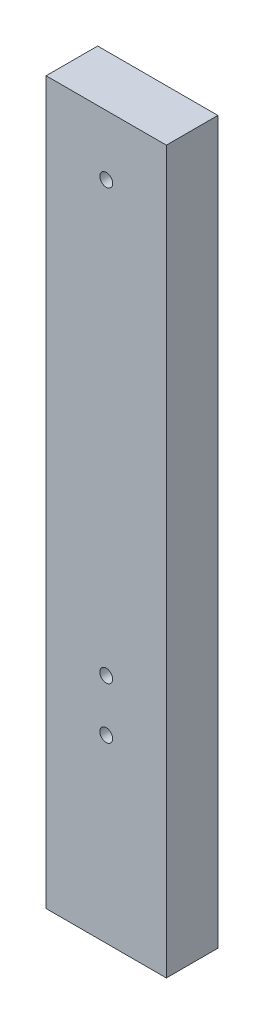
from build123d import *

# Parameters (mm, degrees)
SKETCH1_W                        = 88.9
SKETCH1_H                        = 533.4
BOSS_EXTRUDE1_DEPTH              = 38.1
F_3_8_0_375_DIAMETER_HOLE1_D     = 9.525
F_3_8_0_375_DIAMETER_HOLE1_DEPTH = 76.2
F_3_8_0_375_DIAMETER_HOLE1_TIP   = 2.861598698
SKETCH4_R                        = 4.7625
CUT_EXTRUDE1_DEPTH               = 543.098127648
SKETCH5_R                        = 4.7625
CUT_EXTRUDE2_DEPTH               = 543.098127648


with BuildPart() as part:
    # Sketch1 → Boss-Extrude1 (new body)
    with BuildSketch(Plane.XY):
        with Locations((44.45, 266.7)):
            Rectangle(SKETCH1_W, SKETCH1_H)
    extrude(amount=BOSS_EXTRUDE1_DEPTH)

    # 3/8 (0.375) Diameter Hole1
    with Locations(Plane.XY.offset(38.1)):
        with Locations((44.45, 488.95)):
            Hole(F_3_8_0_375_DIAMETER_HOLE1_D / 2, depth=F_3_8_0_375_DIAMETER_HOLE1_DEPTH)
            with Locations((0, 0, -(F_3_8_0_375_DIAMETER_HOLE1_DEPTH + F_3_8_0_375_DIAMETER_HOLE1_TIP / 2))):  # 118° drill point
                Cone(0, F_3_8_0_375_DIAMETER_HOLE1_D / 2, F_3_8_0_375_DIAMETER_HOLE1_TIP, mode=Mode.SUBTRACT)

    # Sketch4 → Cut-Extrude1 (cut, through all)
    with BuildSketch(Plane.XY.offset(38.1)):
        with Locations((44.45, 133.35)):
            Circle(SKETCH4_R)
    extrude(amount=-CUT_EXTRUDE1_DEPTH, mode=Mode.SUBTRACT)

    # Sketch5 → Cut-Extrude2 (cut, through all)
    with BuildSketch(Plane.XY.offset(38.1)):
        with Locations((44.45, 171.45)):
            Circle(SKETCH5_R)
    extrude(amount=-CUT_EXTRUDE2_DEPTH, mode=Mode.SUBTRACT)


solid = part.part
